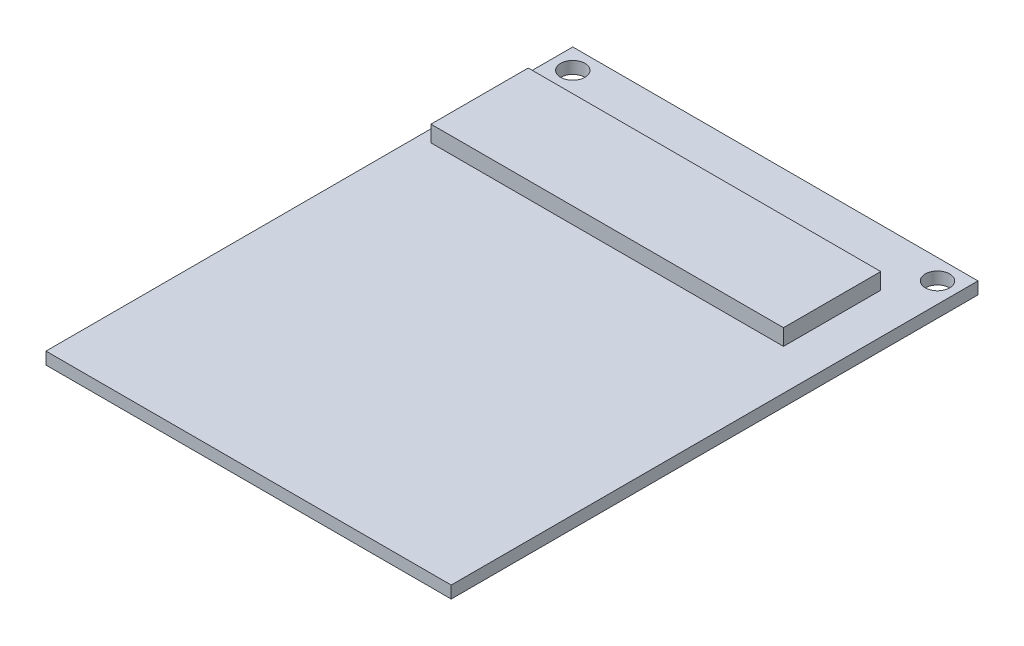
from build123d import *

# Parameters (mm, degrees)
SKETCH1_W           = 50
SKETCH1_H           = 44
SKETCH1_H_2         = 21
BOSS_EXTRUDE1_DEPTH = 1.5
SKETCH2_W           = 43.5
SKETCH2_H           = 12
BOSS_EXTRUDE3_DEPTH = 2
SKETCH4_R           = 1.5
CUT_EXTRUDE1_DEPTH  = 1.5


with BuildPart() as part:
    # Sketch1 → Boss-Extrude1 (new body)
    with BuildSketch(Plane(origin=(0, 0, 0), x_dir=(1, 0, 0), z_dir=(0, 1, 0))):
        with Locations((25, 22)):
            Rectangle(SKETCH1_W, SKETCH1_H)
        with Locations((25, 54.5)):
            Rectangle(SKETCH1_W, SKETCH1_H_2)
    extrude(amount=BOSS_EXTRUDE1_DEPTH)

    # Sketch2 → Boss-Extrude3 (add)
    with BuildSketch(Plane(origin=(0, 1.5, 0), x_dir=(1, 0, 0), z_dir=(0, 1, 0))):
        with Locations((23.25, 52)):
            Rectangle(SKETCH2_W, SKETCH2_H)
    extrude(amount=BOSS_EXTRUDE3_DEPTH)

    # Sketch4 → Cut-Extrude1 (cut)
    with BuildSketch(Plane(origin=(0, 1.5, 0), x_dir=(1, 0, 0), z_dir=(0, 1, 0))):
        with Locations(Location((2.5, 62.5, 0), (0, 0, 270))):
            Circle(SKETCH4_R)
        with Locations(Location((47.5, 62.5, 0), (0, 0, 270))):
            Circle(SKETCH4_R)
    extrude(amount=-CUT_EXTRUDE1_DEPTH, mode=Mode.SUBTRACT)


solid = part.part
